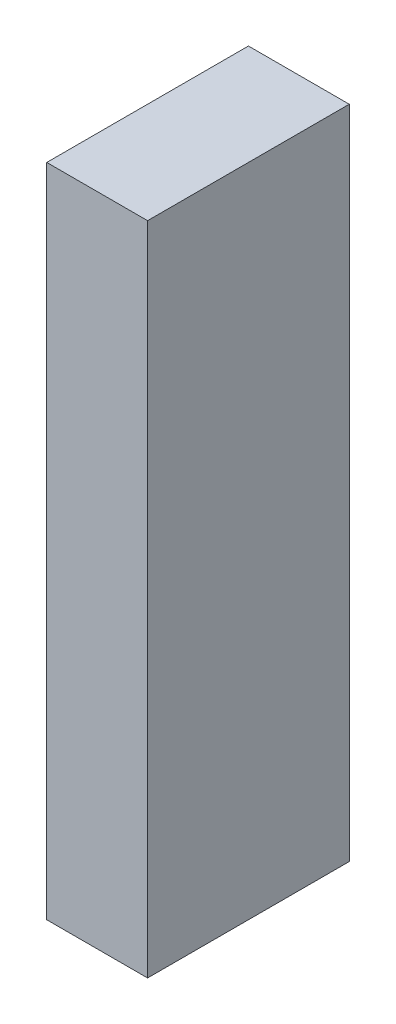
from build123d import *

# Parameters (mm, degrees)
SKETCH1_W           = 10
SKETCH1_H           = 65.046346363
BOSS_EXTRUDE1_DEPTH = 20


with BuildPart() as part:
    # Sketch1 → Boss-Extrude1 (new body)
    with BuildSketch(Plane.XY):
        with Locations((52.853859566, 100.705308433)):
            Rectangle(SKETCH1_W, SKETCH1_H)
    extrude(amount=BOSS_EXTRUDE1_DEPTH)


solid = part.part
